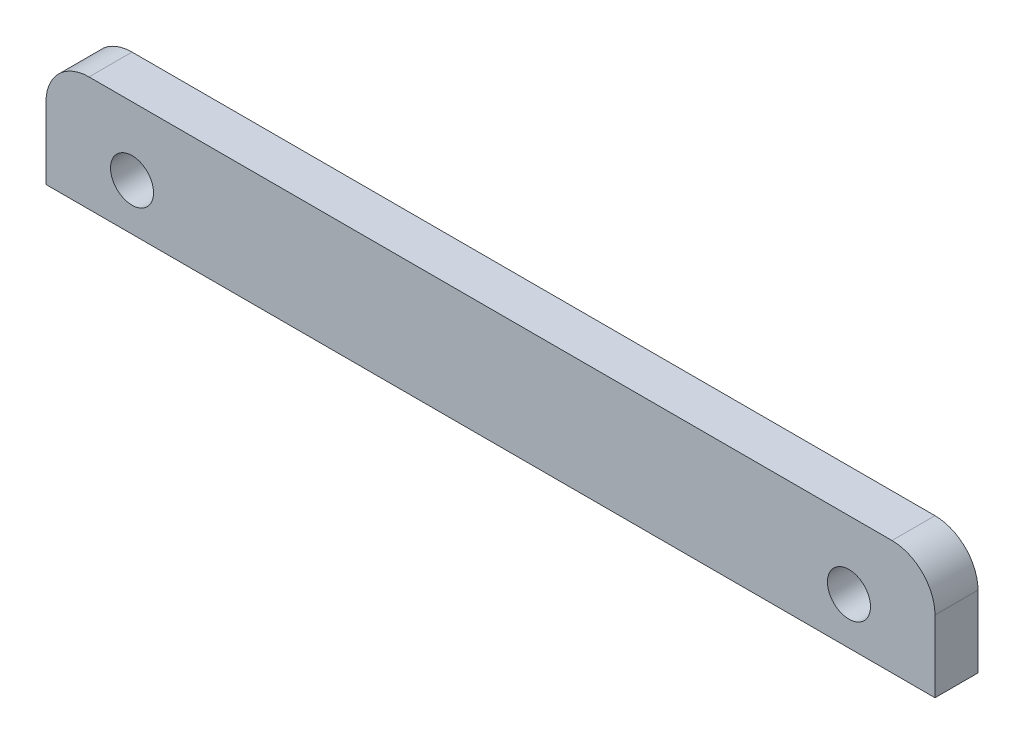
from build123d import *

# Parameters (mm, degrees)
SKETCH1_R           = 1.5
BOSS_EXTRUDE1_DEPTH = 3


with BuildPart() as part:
    # Sketch1 → Boss-Extrude1 (new body)
    with BuildSketch(Plane.XY):
        with BuildLine():
            Line((-28, 5.5), (28, 5.5))
            ThreePointArc((28, 5.5), (30.121320344, 4.621320344), (31, 2.5))
            Line((31, 2.5), (31, -2.5))
            Line((31, -2.5), (-31, -2.5))
            Line((-31, -2.5), (-31, 2.5))
            ThreePointArc((-31, 2.5), (-30.121320344, 4.621320344), (-28, 5.5))
        make_face()
        with Locations((-25, 0.75)):
            Circle(SKETCH1_R, mode=Mode.SUBTRACT)
        with Locations((25, 0.75)):
            Circle(SKETCH1_R, mode=Mode.SUBTRACT)
    extrude(amount=BOSS_EXTRUDE1_DEPTH)


solid = part.part
